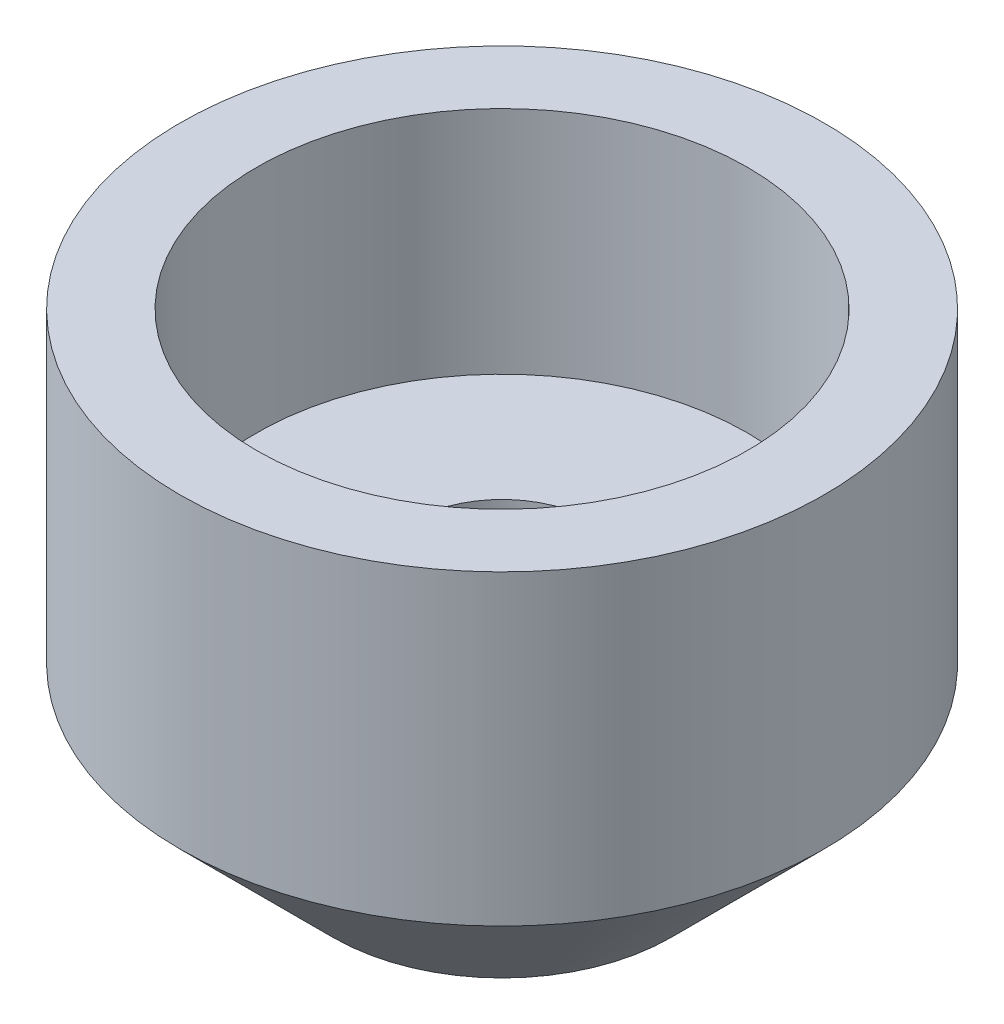
from build123d import *

# Parameters (mm, degrees)
SKETCH1_R           = 10.5
BOSS_EXTRUDE1_DEPTH = 15
SKETCH2_R           = 8
CUT_EXTRUDE1_DEPTH  = 7.5
SKETCH3_R           = 3
CUT_EXTRUDE2_DEPTH  = 7.5
CHAMFER1_SIZE       = 5


with BuildPart() as part:
    # Sketch1 → Boss-Extrude1 (new body)
    with BuildSketch(Plane(origin=(0, 0, 0), x_dir=(1, 0, 0), z_dir=(0, 1, 0))):
        with Locations(Location((0, 0, 0), (0, 0, 270))):
            Circle(SKETCH1_R)
    extrude(amount=BOSS_EXTRUDE1_DEPTH)

    # Sketch2 → Cut-Extrude1 (cut)
    with BuildSketch(Plane(origin=(0, 15, 0), x_dir=(1, 0, 0), z_dir=(0, 1, 0))):
        with Locations(Location((0, 0, 0), (0, 0, 270))):
            Circle(SKETCH2_R)
    extrude(amount=-CUT_EXTRUDE1_DEPTH, mode=Mode.SUBTRACT)

    # Sketch3 → Cut-Extrude2 (cut)
    with BuildSketch(Plane.XZ):
        with Locations(Location((0, 0, 0), (0, 0, 270))):
            Circle(SKETCH3_R)
    extrude(amount=-CUT_EXTRUDE2_DEPTH, mode=Mode.SUBTRACT)

    # Chamfer1
    chamfer1_edges = [part.edges().sort_by_distance(p)[0] for p in [
        (0, 0, -10.5),
    ]]
    chamfer(chamfer1_edges, length=CHAMFER1_SIZE)


solid = part.part
